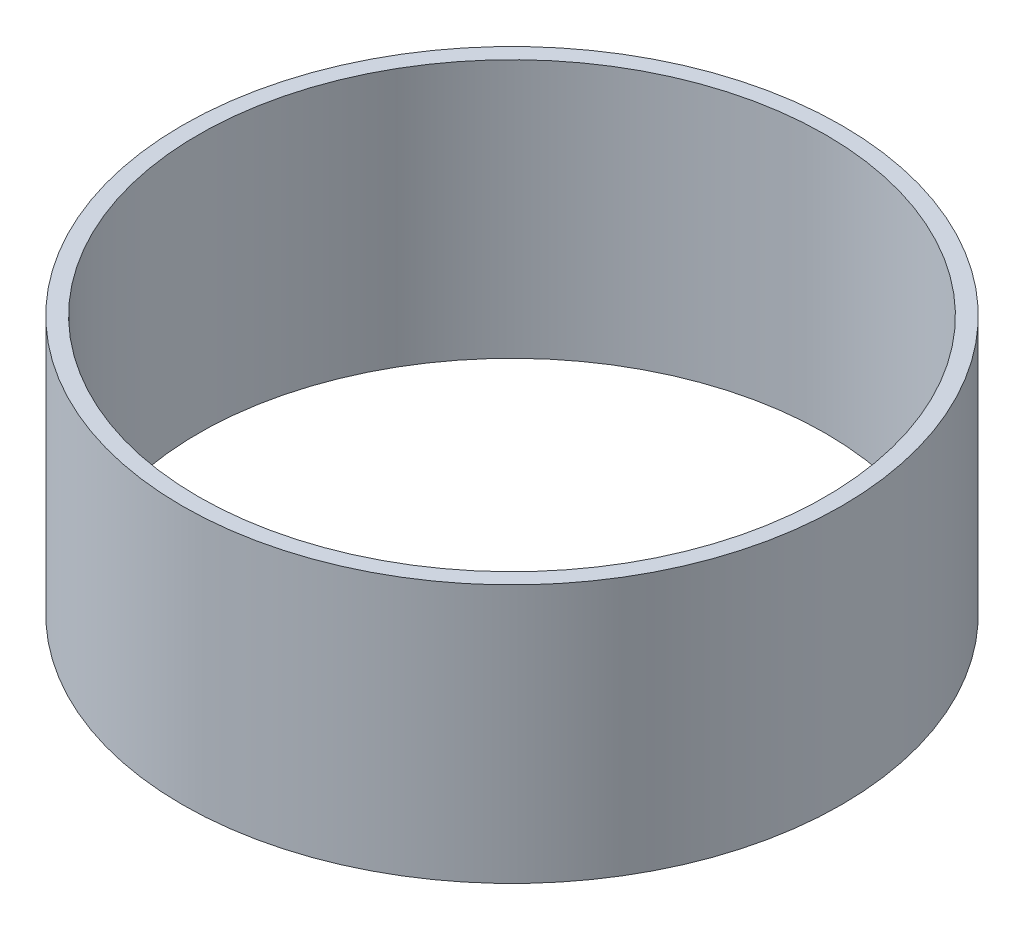
from build123d import *

# Parameters (mm, degrees)
SKETCH_1_R      = 51
SKETCH_1_R_2    = 48.5
EXTRUDE_1_DEPTH = 20


with BuildPart() as part:
    # 草图1 → 凸台-拉伸1 (new, symmetric)
    with BuildSketch(Plane(origin=(0, 0, 0), x_dir=(1, 0, 0), z_dir=(0, 1, 0))):
        with Locations(Location((0, 0, 0), (0, 0, 270))):
            Circle(SKETCH_1_R)
        with Locations(Location((0, 0, 0), (0, 0, 270))):
            Circle(SKETCH_1_R_2, mode=Mode.SUBTRACT)
    extrude(amount=EXTRUDE_1_DEPTH, both=True)


solid = part.part
